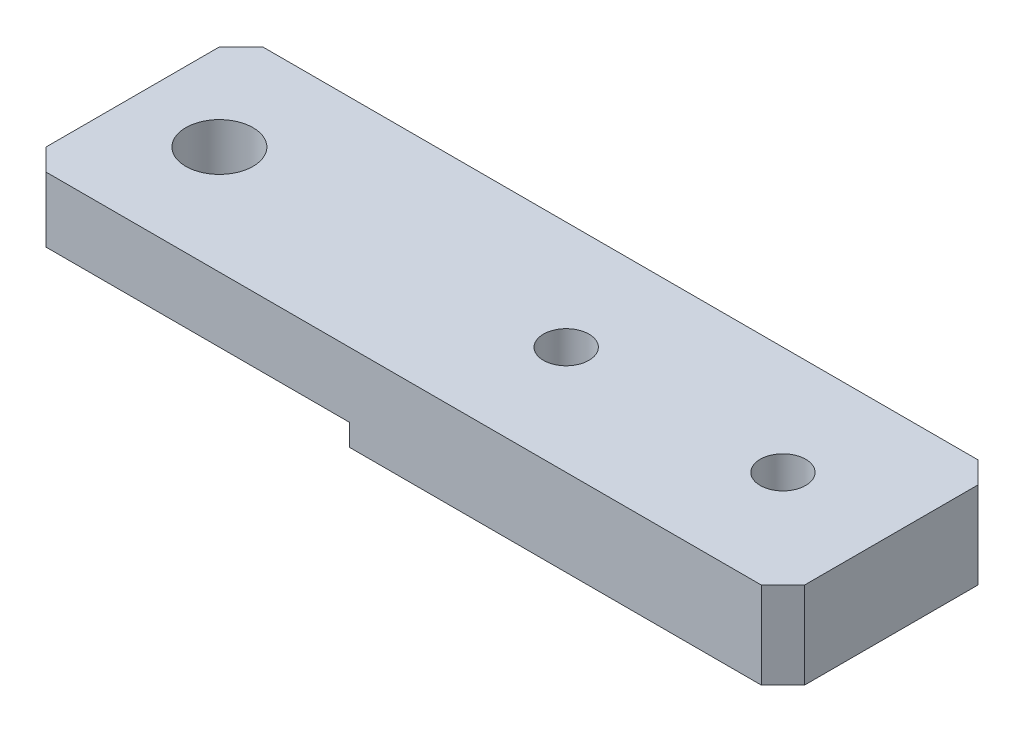
from build123d import *

# Parameters (mm, degrees)
EXTRUDE_1_DEPTH     = 10
SKETCH_3_R          = 5
EXTRUDE_2_DEPTH     = 2
CHAMFER_1_SIZE      = 2
CHAMFER_2_SIZE      = 2
SKETCH_4_R          = 2.1
SKETCH_4_R_2        = 3.1
CUT_EXTRUDE_1_DEPTH = 72.161787499
FILLET_1_R          = 1


with BuildPart() as part:
    # 草图1 → 凸台-拉伸1 (new, symmetric)
    with BuildSketch(Plane.XY):
        Polygon((0, 4), (0, 10), (70, 10), (70, 2), (30, 2), (30, 4), align=None)
    extrude(amount=EXTRUDE_1_DEPTH, both=True)

    # 草图3 → 凸台-拉伸2 (add)
    with BuildSketch(Plane.XZ.offset(-4)):
        with Locations(Location((8, 0, 0), (0, 0, 90))):
            Circle(SKETCH_3_R)
    extrude(amount=EXTRUDE_2_DEPTH)

    # 倒角1
    chamfer_1_edges = [part.edges().sort_by_distance(p)[0] for p in [
        (0, 7, -10),
        (0, 7, 10),
    ]]
    chamfer(chamfer_1_edges, length=CHAMFER_1_SIZE)

    # 倒角2
    chamfer_2_edges = [part.edges().sort_by_distance(p)[0] for p in [
        (70, 6, 10),
        (70, 6, -10),
    ]]
    chamfer(chamfer_2_edges, length=CHAMFER_2_SIZE)

    # 草图4 → 切除-拉伸1 (cut, through all)
    with BuildSketch(Plane.XZ.offset(-2)):
        with Locations((40, 0)):
            Circle(SKETCH_4_R)
        with Locations((60, 0)):
            Circle(SKETCH_4_R)
        with Locations((8, 0)):
            Circle(SKETCH_4_R_2)
    extrude(amount=-CUT_EXTRUDE_1_DEPTH, mode=Mode.SUBTRACT)

    # 圆角1
    fillet_1_edges = [part.edges().sort_by_distance(p)[0] for p in [
        (8, 4, -5),
    ]]
    fillet(fillet_1_edges, radius=FILLET_1_R)


solid = part.part
